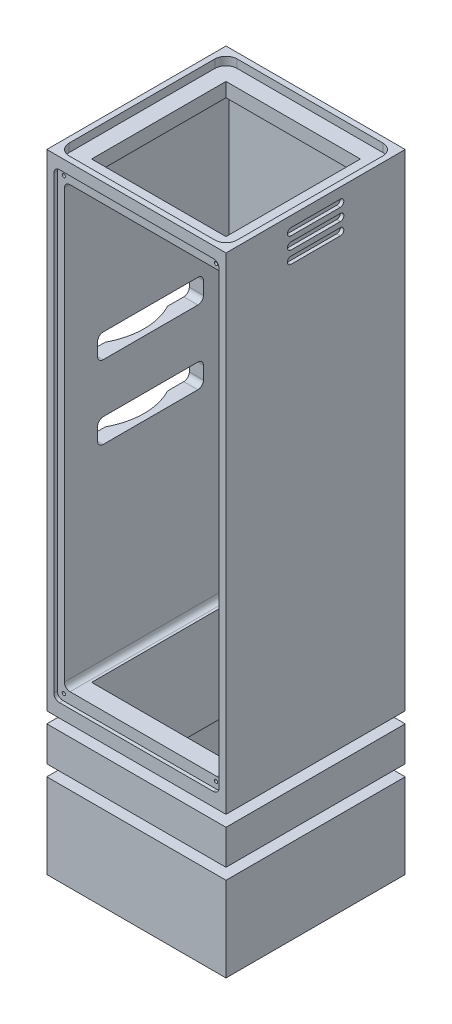
from build123d import *

# Parameters (mm, degrees)
SKETCH1_W                    = 50.8
SKETCH1_H                    = 50.8
SKETCH1_W_2                  = 38.1
SKETCH1_H_2                  = 38.1
BOSS_EXTRUDE1_DEPTH          = 178
SKETCH2_W                    = 44.8
SKETCH2_H                    = 44.8
SKETCH2_W_2                  = 38.1
SKETCH2_H_2                  = 38.1
CUT_EXTRUDE1_DEPTH           = 20
SKETCH3_W                    = 46.8
SKETCH3_H                    = 124.475000116
CUT_EXTRUDE2_DEPTH           = 47.625
SKETCH4_W                    = 50.8
SKETCH4_H                    = 3.175
CUT_EXTRUDE3_DEPTH           = 3.175
SKETCH5_W                    = 3.175
SKETCH5_H                    = 3.175
CUT_EXTRUDE4_DEPTH           = 192.951243809
CUT_EXTRUDE5_DEPTH           = 1
SKETCH7_W                    = 46.8
SKETCH7_H                    = 3.175
CUT_EXTRUDE6_DEPTH           = 1
FILLET1_R                    = 1.5875
CUT_EXTRUDE7_DEPTH           = 2.34442
M1_2X0_25_TAPPED_HOLE1_D     = 0.95
M1_2X0_25_TAPPED_HOLE1_DEPTH = 2.9997
M1_2X0_25_TAPPED_HOLE1_TIP   = 0.285408794
BOSS_EXTRUDE2_REACH          = 193.689
CUT_EXTRUDE8_REACH           = 193.951
SKETCH15_W                   = 30
SKETCH15_H                   = 6.8
FILLET2_R                    = 1.5875
LPATTERN1_COUNT              = 2
LPATTERN1_PITCH              = 20.8


with BuildPart() as part:
    # Sketch1 → Boss-Extrude1 (new body)
    with BuildSketch(Plane(origin=(0, 0, 0), x_dir=(1, 0, 0), z_dir=(0, 1, 0))):
        with Locations((25.4, 25.4)):
            Rectangle(SKETCH1_W, SKETCH1_H)
        with Locations((25.4, 25.4)):
            Rectangle(SKETCH1_W_2, SKETCH1_H_2, mode=Mode.SUBTRACT)
    extrude(amount=BOSS_EXTRUDE1_DEPTH)

    # Sketch2 → Cut-Extrude1 (cut)
    with BuildSketch(Plane.XZ):
        with Locations((25.4, -25.4)):
            Rectangle(SKETCH2_W, SKETCH2_H)
        with Locations((25.4, -25.4)):
            Rectangle(SKETCH2_W_2, SKETCH2_H_2, mode=Mode.SUBTRACT)
    extrude(amount=-CUT_EXTRUDE1_DEPTH, mode=Mode.SUBTRACT)

    # Sketch3 → Cut-Extrude2 (cut)
    with BuildSketch(Plane.XY):
        with Locations((25.4, 109.412499942)):
            Rectangle(SKETCH3_W, SKETCH3_H)
    extrude(amount=-CUT_EXTRUDE2_DEPTH, mode=Mode.SUBTRACT)

    # Sketch4 → Cut-Extrude3 (cut)
    with BuildSketch(Plane.XY):
        with Locations((25.4, 25.5875)):
            Rectangle(SKETCH4_W, SKETCH4_H)
        with Locations((25.4, 38.5875)):
            Rectangle(SKETCH4_W, SKETCH4_H)
    cut_extrude3 = extrude(amount=-CUT_EXTRUDE3_DEPTH, mode=Mode.SUBTRACT)

    # Sketch5 → Cut-Extrude4 (cut, through all)
    with BuildSketch(Plane.XY):
        with Locations((1.5875, 38.5875)):
            Rectangle(SKETCH5_W, SKETCH5_H)
        with Locations((1.5875, 25.5875)):
            Rectangle(SKETCH5_W, SKETCH5_H)
    cut_extrude4 = extrude(amount=-CUT_EXTRUDE4_DEPTH, mode=Mode.SUBTRACT)

    # Sketch6 → Cut-Extrude5 (cut)
    with BuildSketch(Plane.ZY):
        with BuildLine():
            Line((-32.4, 175), (-18.4, 175))
            ThreePointArc((-18.4, 175), (-17.4, 174), (-18.4, 173))
            Line((-18.4, 173), (-32.4, 173))
            ThreePointArc((-32.4, 173), (-33.4, 174), (-32.4, 175))
        make_face()
        with BuildLine():
            Line((-32.4, 171.5), (-18.4, 171.5))
            ThreePointArc((-18.4, 171.5), (-17.4, 170.5), (-18.4, 169.5))
            Line((-18.4, 169.5), (-32.4, 169.5))
            ThreePointArc((-32.4, 169.5), (-33.4, 170.5), (-32.4, 171.5))
        make_face()
        with BuildLine():
            Line((-32.4, 168), (-18.4, 168))
            ThreePointArc((-18.4, 168), (-17.4, 167), (-18.4, 166))
            Line((-18.4, 166), (-32.4, 166))
            ThreePointArc((-32.4, 166), (-33.4, 167), (-32.4, 168))
        make_face()
    cut_extrude5 = extrude(amount=-CUT_EXTRUDE5_DEPTH, mode=Mode.SUBTRACT)

    # Mirror1: Cut-Extrude3 across plane
    add(cut_extrude3.mirror(Plane.XY.offset(-25.4)), mode=Mode.SUBTRACT)

    # Mirror2: Cut-Extrude4, Cut-Extrude5 across plane
    add(cut_extrude4.mirror(Plane.ZY.offset(-25.4)), mode=Mode.SUBTRACT)
    add(cut_extrude5.mirror(Plane.ZY.offset(-25.4)), mode=Mode.SUBTRACT)

    # Sketch7 → Cut-Extrude6 (cut)
    with BuildSketch(Plane.XY):
        with Locations((25.4, 173.2375)):
            Rectangle(SKETCH7_W, SKETCH7_H)
        with Locations((25.4, 45.587499884)):
            Rectangle(SKETCH7_W, SKETCH7_H)
    extrude(amount=-CUT_EXTRUDE6_DEPTH, mode=Mode.SUBTRACT)

    # Fillet1
    fillet1_edges = [part.edges().sort_by_distance(p)[0] for p in [
        (47.8, 10, -3),
        (47.8, 10, -47.8),
        (2, 174.825, -0.5),
        (48.8, 174.825, -0.5),
        (3, 10, -47.8),
        (2, 43.999999884, -0.5),
        (3, 10, -3),
        (48.8, 43.999999884, -0.5),
        (2, 47.174999884, -24.3125),
        (2, 171.65, -24.3125),
        (48.8, 171.65, -24.3125),
        (48.8, 47.174999884, -24.3125),
    ]]
    fillet(fillet1_edges, radius=FILLET1_R)

    # Sketch8 → Cut-Extrude7 (cut)
    with BuildSketch(Plane(origin=(0, 178, 0), x_dir=(1, 0, 0), z_dir=(0, 1, 0))):
        with BuildLine():
            Line((4.7625, 49.2125), (46.0375, 49.2125))
            ThreePointArc((46.0375, 49.2125), (48.28256403, 48.28256403), (49.2125, 46.0375))
            Line((49.2125, 46.0375), (49.2125, 4.7625))
            ThreePointArc((49.2125, 4.7625), (48.28256403, 2.51743597), (46.0375, 1.5875))
            Line((46.0375, 1.5875), (4.7625, 1.5875))
            ThreePointArc((4.7625, 1.5875), (2.51743597, 2.51743597), (1.5875, 4.7625))
            Line((1.5875, 4.7625), (1.5875, 46.0375))
            ThreePointArc((1.5875, 46.0375), (2.51743597, 48.28256403), (4.7625, 49.2125))
        make_face()
    extrude(amount=-CUT_EXTRUDE7_DEPTH, mode=Mode.SUBTRACT)

    # M1.2x0.25 Tapped Hole1
    with Locations(Plane.XY.offset(-1)):
        with Locations((3.8415, 172.98375321), (46.95875321, 172.98375321), (3.8415, 45.841499884), (46.95875321, 45.841499884)):
            Hole(M1_2X0_25_TAPPED_HOLE1_D / 2, depth=M1_2X0_25_TAPPED_HOLE1_DEPTH)
            with Locations((0, 0, -(M1_2X0_25_TAPPED_HOLE1_DEPTH + M1_2X0_25_TAPPED_HOLE1_TIP / 2))):  # 118° drill point
                Cone(0, M1_2X0_25_TAPPED_HOLE1_D / 2, M1_2X0_25_TAPPED_HOLE1_TIP, mode=Mode.SUBTRACT)

    # Sketch17 → Boss-Extrude2 (add, up to next)
    with BuildSketch(Plane.XY.offset(-1), mode=Mode.PRIVATE) as boss_extrude2_sk1:
        with BuildLine():
            Line((2, 170.0625), (2, 48.762499884))
            ThreePointArc((2, 48.762499884), (2.464967985, 47.639967869), (3.5875, 47.174999884))
            Line((3.5875, 47.174999884), (5.5875, 47.174999884))
            ThreePointArc((5.5875, 47.174999884), (4.464967985, 47.639967869), (4, 48.762499884))
            Line((4, 48.762499884), (4, 170.0625))
            ThreePointArc((4, 170.0625), (4.464967985, 171.185032015), (5.5875, 171.65))
            Line((5.5875, 171.65), (3.5875, 171.65))
            ThreePointArc((3.5875, 171.65), (2.464967985, 171.185032015), (2, 170.0625))
        make_face()
    boss_extrude2_tool1 = extrude(boss_extrude2_sk1.sketch, amount=-BOSS_EXTRUDE2_REACH, mode=Mode.PRIVATE) - part.part
    add(boss_extrude2_tool1.solids().sort_by_distance((3.00869, 109.4125, -1))[0])

    # Sketch15 → Cut-Extrude8 (cut, up to next)
    with BuildSketch(Plane.ZY, mode=Mode.PRIVATE) as cut_extrude8_sk1:
        with Locations((-25.4, 105)):
            Rectangle(SKETCH15_W, SKETCH15_H)
    cut_extrude8_tool1 = extrude(cut_extrude8_sk1.sketch, amount=-CUT_EXTRUDE8_REACH, mode=Mode.PRIVATE) & part.part
    # Sketch15 → Cut-Extrude8 (cut, up to next)
    with BuildSketch(Plane.ZY, mode=Mode.PRIVATE) as cut_extrude8_sk2:
        with Locations((-25.4, 125.8)):
            Rectangle(SKETCH15_W, SKETCH15_H)
    cut_extrude8_tool2 = extrude(cut_extrude8_sk2.sketch, amount=-CUT_EXTRUDE8_REACH, mode=Mode.PRIVATE) & part.part
    add(cut_extrude8_tool1.solids().sort_by_distance((0, 105, -25.4))[0], mode=Mode.SUBTRACT)
    add(cut_extrude8_tool2.solids().sort_by_distance((0, 125.8, -25.4))[0], mode=Mode.SUBTRACT)

    # Fillet2
    fillet2_edges = [part.edges().sort_by_distance(p)[0] for p in [
        (2, 101.6, -10.4),
        (2, 108.4, -10.4),
        (2, 108.4, -40.4),
        (2, 101.6, -40.4),
        (2, 122.4, -10.4),
        (2, 129.2, -10.4),
        (2, 129.2, -40.4),
        (2, 122.4, -40.4),
    ]]
    fillet(fillet2_edges, radius=FILLET2_R)

    # Sketch20 → Cut-Revolve1 (revolve, cut)
    with BuildSketch(Plane(origin=(0, 125.8, 0), x_dir=(1, 0, 0), z_dir=(0, 1, 0))):
        with BuildLine():
            Line((-16.55, 25.4), (2.5, 25.4))
            ThreePointArc((2.5, 25.4), (-16.55, 6.35), (-35.6, 25.4))
            Line((-35.6, 25.4), (-16.55, 25.4))
        make_face()
    cut_revolve1 = revolve(axis=Axis((-16.55, 125.8, -25.4), (1, 0, 0)), mode=Mode.SUBTRACT)

    # LPattern1: Cut-Revolve1 ×2
    with Locations(*[(0, -i * LPATTERN1_PITCH, 0) for i in range(1, LPATTERN1_COUNT)]):
        add(cut_revolve1, mode=Mode.SUBTRACT)


solid = part.part
